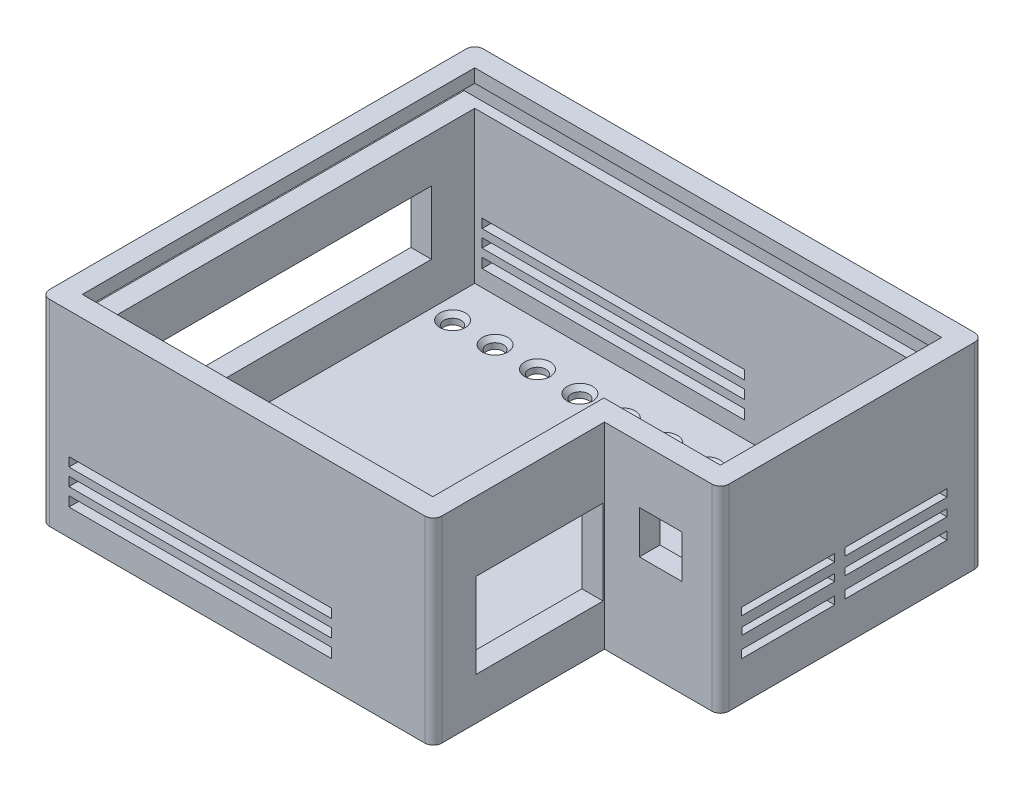
from build123d import *

# Parameters (mm, degrees)
BOSS_EXTRUDE1_DEPTH = 55.88
SKETCH25_W          = 88.9
SKETCH25_H          = 19.05
CUT_EXTRUDE9_DEPTH  = 45
SKETCH26_W          = 30.523269702
SKETCH26_H          = 2.237493103
SKETCH26_W_2        = 27.906523593
SKETCH26_H_2        = 2.373023229
SKETCH26_W_3        = 27.753916876
SKETCH26_H_3        = 2.119290111
SKETCH26_W_4        = 27.886795766
CUT_EXTRUDE10_DEPTH = 45
SKETCH27_W          = 78.529626093
SKETCH27_H          = 2.934693649
SKETCH27_H_2        = 2.6992147
SKETCH27_H_3        = 2.709324196
CUT_EXTRUDE11_DEPTH = 254
SKETCH23_W          = 12.7
SKETCH23_H          = 12.812800452
CUT_EXTRUDE12_DEPTH = 50.8
SKETCH31_W          = 123.564738067
SKETCH31_H          = 6.504927573
CUT_EXTRUDE13_DEPTH = 113.8
SKETCH34_W          = 2.794
SKETCH34_H          = 6
SKETCH34_W_2        = 3
SKETCH34_H_2        = 6.504927573
CUT_EXTRUDE14_DEPTH = 35.8
SKETCH35_W          = 66.242375008
SKETCH35_H          = 6
CUT_EXTRUDE15_DEPTH = 2.8
BOSS_EXTRUDE2_DEPTH = 3
SKETCH38_W          = 38.1
SKETCH38_H          = 25.4
CUT_EXTRUDE17_DEPTH = 10.16
FILLET1_R           = 2.54
SKETCH37_R          = 2.54
CUT_EXTRUDE18_DEPTH = 5.842
CHAMFER1_SIZE       = 1.27


with BuildPart() as part:
    # Sketch1 → Boss-Extrude1 (new body)
    with BuildSketch(Plane(origin=(0, 0, 0), x_dir=(1, 0, 0), z_dir=(0, 1, 0))):
        Polygon((104.775, 6.175), (-6.175, 6.175), (-6.175, -123.65), (104.902, -123.65), (111.252, -123.65), (111.252, -72.417375008), (145.95, -72.417375008), (145.95, 6.175), align=None)
        Polygon((0, 0), (104.775, 0), (139.775, 0), (139.775, -66.242375008), (107.949403386, -66.242375008), (104.902, -66.242375008), (104.902, -117.475), (0, -117.475), align=None, mode=Mode.SUBTRACT)
    extrude(amount=BOSS_EXTRUDE1_DEPTH)

    # Sketch25 → Cut-Extrude9 (cut)
    with BuildSketch(Plane.ZY.offset(6.175)):
        with Locations((57.39554729, 22.225)):
            Rectangle(SKETCH25_W, SKETCH25_H)
    extrude(amount=-CUT_EXTRUDE9_DEPTH, mode=Mode.SUBTRACT)

    # Sketch26 → Cut-Extrude10 (cut)
    with BuildSketch(Plane(origin=(145.95, 0, 0), x_dir=(0, 0, -1), z_dir=(1, 0, 0))):
        with Locations((-19.859686164, 20.955094684)):
            Rectangle(SKETCH26_W, SKETCH26_H)
        with Locations((-52.150571232, 9.901663162)):
            Rectangle(SKETCH26_W_2, SKETCH26_H_2)
        with Locations((-19.859686164, 9.901663162)):
            Rectangle(SKETCH26_W, SKETCH26_H_2)
        with Locations((-52.074267873, 15.812585987)):
            Rectangle(SKETCH26_W_3, SKETCH26_H_3)
        with Locations((-19.859686164, 15.812585987)):
            Rectangle(SKETCH26_W, SKETCH26_H_3)
        with Locations((-52.140707318, 20.955094684)):
            Rectangle(SKETCH26_W_4, SKETCH26_H)
    extrude(amount=-CUT_EXTRUDE10_DEPTH, mode=Mode.SUBTRACT)

    # Sketch27 → Cut-Extrude11 (cut)
    with BuildSketch(Plane(origin=(0, 0, -6.175), x_dir=(-1, 0, 0), z_dir=(0, 0, -1))):
        with Locations((-41.456138019, 6.407058623)):
            Rectangle(SKETCH27_W, SKETCH27_H)
        with Locations((-41.456138019, 11.590217132)):
            Rectangle(SKETCH27_W, SKETCH27_H_2)
        with Locations((-41.456138019, 16.660698202)):
            Rectangle(SKETCH27_W, SKETCH27_H_3)
    extrude(amount=-CUT_EXTRUDE11_DEPTH, mode=Mode.SUBTRACT)

    # Sketch23 → Cut-Extrude12 (cut)
    with BuildSketch(Plane.XY.offset(72.417375008)):
        with Locations((128.04011729, 32.5625418)):
            Rectangle(SKETCH23_W, SKETCH23_H)
    extrude(amount=-CUT_EXTRUDE12_DEPTH, mode=Mode.SUBTRACT)

    # Sketch31 → Cut-Extrude13 (cut)
    with BuildSketch(Plane.ZY.offset(6.175)):
        with Locations((58.782369034, 48.622896581)):
            Rectangle(SKETCH31_W, SKETCH31_H)
    extrude(amount=-CUT_EXTRUDE13_DEPTH, mode=Mode.SUBTRACT)

    # Sketch34 → Cut-Extrude14 (cut)
    with BuildSketch(Plane.ZY.offset(-107.625)):
        with Locations((67.639375008, 48.370432794)):
            Rectangle(SKETCH34_W, SKETCH34_H)
        with Locations((-1.5, 48.622896581)):
            Rectangle(SKETCH34_W_2, SKETCH34_H_2)
    extrude(amount=-CUT_EXTRUDE14_DEPTH, mode=Mode.SUBTRACT)

    # Sketch35 → Cut-Extrude15 (cut)
    with BuildSketch(Plane.ZY.offset(-139.775)):
        with Locations((33.121187504, 48.370432794)):
            Rectangle(SKETCH35_W, SKETCH35_H)
    extrude(amount=-CUT_EXTRUDE15_DEPTH, mode=Mode.SUBTRACT)

    # Sketch36 → Boss-Extrude2 (add)
    with BuildSketch(Plane.XZ):
        Polygon((111.252, 72.417375008), (111.252, 123.65), (-6.175, 123.65), (-6.175, -6.175), (145.95, -6.175), (145.95, 72.417375008), align=None)
    extrude(amount=BOSS_EXTRUDE2_DEPTH)

    # Sketch38 → Cut-Extrude17 (cut)
    with BuildSketch(Plane(origin=(111.252, 0, 0), x_dir=(0, 0, -1), z_dir=(1, 0, 0))):
        with Locations((-91.9, 22.4)):
            Rectangle(SKETCH38_W, SKETCH38_H)
    extrude(amount=-CUT_EXTRUDE17_DEPTH, mode=Mode.SUBTRACT)

    # Fillet1
    fillet1_edges = [part.edges().sort_by_distance(p)[0] for p in [
        (145.95, 26.44, -6.175),
        (145.95, 26.44, 72.417375008),
        (111.252, 26.44, 123.65),
        (-6.175, 26.44, 123.65),
        (-6.175, 26.44, -6.175),
    ]]
    fillet(fillet1_edges, radius=FILLET1_R)

    # Sketch37 → Cut-Extrude18 (cut)
    with BuildSketch(Plane(origin=(145.95, -3, 72.417375008), x_dir=(1, 0, 0), z_dir=(0, -1, 0))):
        with Locations(Location((-12.7, -59.542375008, 0), (0, 0, 270))):
            Circle(SKETCH37_R)
        with Locations(Location((-63.5, 29.357624992, 0), (0, 0, 270))):
            Circle(SKETCH37_R)
        with Locations(Location((-114.3, 29.357624992, 0), (0, 0, 270))):
            Circle(SKETCH37_R)
        with Locations(Location((-25.4, -59.542375008, 0), (0, 0, 270))):
            Circle(SKETCH37_R)
        with Locations(Location((-38.1, -59.542375008, 0), (0, 0, 270))):
            Circle(SKETCH37_R)
        with Locations(Location((-50.8, -59.542375008, 0), (0, 0, 270))):
            Circle(SKETCH37_R)
        with Locations(Location((-63.5, -59.542375008, 0), (0, 0, 270))):
            Circle(SKETCH37_R)
        with Locations(Location((-76.2, -59.542375008, 0), (0, 0, 270))):
            Circle(SKETCH37_R)
        with Locations(Location((-88.9, -59.542375008, 0), (0, 0, 270))):
            Circle(SKETCH37_R)
        with Locations(Location((-101.6, -59.542375008, 0), (0, 0, 270))):
            Circle(SKETCH37_R)
        with Locations(Location((-114.3, -59.542375008, 0), (0, 0, 270))):
            Circle(SKETCH37_R)
        with Locations(Location((-127, -59.542375008, 0), (0, 0, 270))):
            Circle(SKETCH37_R)
        with Locations(Location((-139.7, -59.542375008, 0), (0, 0, 270))):
            Circle(SKETCH37_R)
    extrude(amount=-CUT_EXTRUDE18_DEPTH, mode=Mode.SUBTRACT)

    # Chamfer1
    chamfer1_edges = [part.edges().sort_by_distance(p)[0] for p in [
        (133.25, 0, 15.415),
        (6.25, 0, 15.415),
        (18.95, 0, 15.415),
        (31.65, 0, 15.415),
        (44.35, 0, 15.415),
        (82.45, 0, 104.315),
        (31.65, 0, 104.315),
        (120.55, 0, 15.415),
        (107.85, 0, 15.415),
        (95.15, 0, 15.415),
        (82.45, 0, 15.415),
        (69.75, 0, 15.415),
        (57.05, 0, 15.415),
    ]]
    chamfer(chamfer1_edges, length=CHAMFER1_SIZE)


solid = part.part
